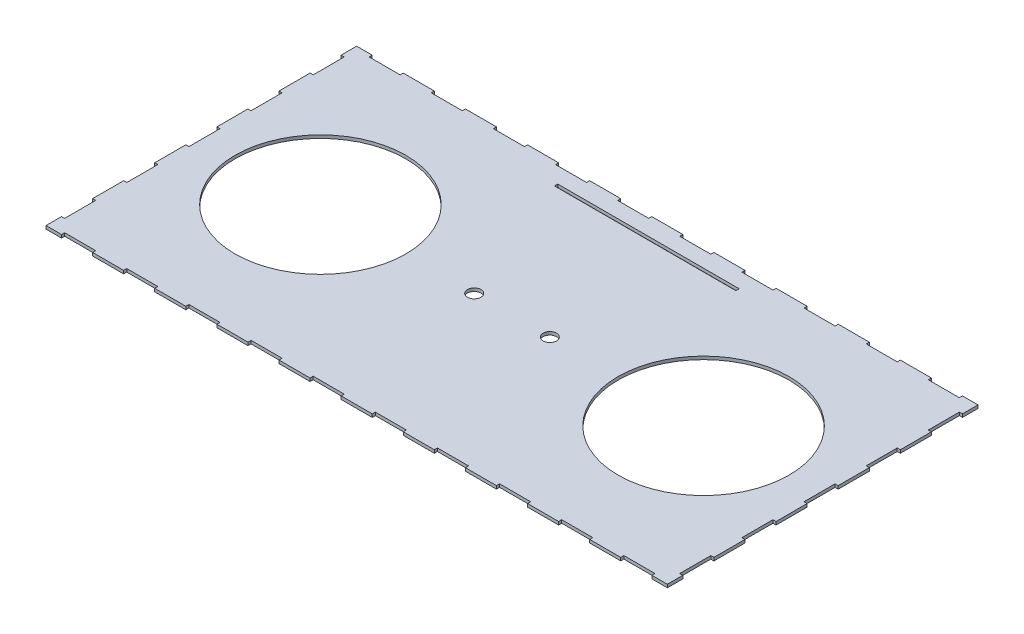
from build123d import *

# Parameters (mm, degrees)
SKETCH1_W           = 600
SKETCH1_H           = 300
BOSS_EXTRUDE1_DEPTH = 3
SKETCH2_R           = 82.5
SKETCH2_R_2         = 6.5
SKETCH2_W           = 30
SKETCH2_H           = 3
SKETCH2_W_2         = 3
SKETCH2_H_2         = 30
CUT_EXTRUDE2_DEPTH  = 5
SKETCH3_W           = 175.2
SKETCH3_H           = 3.2
CUT_EXTRUDE3_DEPTH  = 10


with BuildPart() as part:
    # Sketch1 → Boss-Extrude1 (new body)
    with BuildSketch(Plane(origin=(0, 0, 0), x_dir=(1, 0, 0), z_dir=(0, 1, 0))):
        with Locations((300, 150)):
            Rectangle(SKETCH1_W, SKETCH1_H)
    extrude(amount=BOSS_EXTRUDE1_DEPTH)

    # Sketch2 → Cut-Extrude2 (cut)
    with BuildSketch(Plane(origin=(0, 3, 0), x_dir=(1, 0, 0), z_dir=(0, 1, 0))):
        with Locations(Location((115, 150, 0), (0, 0, 270))):
            Circle(SKETCH2_R)
        with Locations(Location((263.5, 150, 0), (0, 0, 270))):
            Circle(SKETCH2_R_2)
        with Locations(Location((336.5, 150, 0), (0, 0, 90))):
            Circle(SKETCH2_R_2)
        with Locations(Location((485, 150, 0), (0, 0, 90))):
            Circle(SKETCH2_R)
        with Locations((90, 1.5)):
            Rectangle(SKETCH2_W, SKETCH2_H)
        with Locations((30, 1.5)):
            Rectangle(SKETCH2_W, SKETCH2_H)
        with Locations((150, 1.5)):
            Rectangle(SKETCH2_W, SKETCH2_H)
        with Locations((210, 1.5)):
            Rectangle(SKETCH2_W, SKETCH2_H)
        with Locations((270, 1.5)):
            Rectangle(SKETCH2_W, SKETCH2_H)
        with Locations((330, 1.5)):
            Rectangle(SKETCH2_W, SKETCH2_H)
        with Locations((390, 1.5)):
            Rectangle(SKETCH2_W, SKETCH2_H)
        with Locations((450, 1.5)):
            Rectangle(SKETCH2_W, SKETCH2_H)
        with Locations((510, 1.5)):
            Rectangle(SKETCH2_W, SKETCH2_H)
        with Locations((570, 1.5)):
            Rectangle(SKETCH2_W, SKETCH2_H)
        with Locations((570, 298.5)):
            Rectangle(SKETCH2_W, SKETCH2_H)
        with Locations((510, 298.5)):
            Rectangle(SKETCH2_W, SKETCH2_H)
        with Locations((450, 298.5)):
            Rectangle(SKETCH2_W, SKETCH2_H)
        with Locations((390, 298.5)):
            Rectangle(SKETCH2_W, SKETCH2_H)
        with Locations((330, 298.5)):
            Rectangle(SKETCH2_W, SKETCH2_H)
        with Locations((270, 298.5)):
            Rectangle(SKETCH2_W, SKETCH2_H)
        with Locations((210, 298.5)):
            Rectangle(SKETCH2_W, SKETCH2_H)
        with Locations((150, 298.5)):
            Rectangle(SKETCH2_W, SKETCH2_H)
        with Locations((90, 298.5)):
            Rectangle(SKETCH2_W, SKETCH2_H)
        with Locations((30, 298.5)):
            Rectangle(SKETCH2_W, SKETCH2_H)
        with Locations((1.5, 210)):
            Rectangle(SKETCH2_W_2, SKETCH2_H_2)
        with Locations((1.5, 270)):
            Rectangle(SKETCH2_W_2, SKETCH2_H_2)
        with Locations((1.5, 150)):
            Rectangle(SKETCH2_W_2, SKETCH2_H_2)
        with Locations((1.5, 90)):
            Rectangle(SKETCH2_W_2, SKETCH2_H_2)
        with Locations((1.5, 30)):
            Rectangle(SKETCH2_W_2, SKETCH2_H_2)
        with Locations((598.5, 30)):
            Rectangle(SKETCH2_W_2, SKETCH2_H_2)
        with Locations((598.5, 90)):
            Rectangle(SKETCH2_W_2, SKETCH2_H_2)
        with Locations((598.5, 150)):
            Rectangle(SKETCH2_W_2, SKETCH2_H_2)
        with Locations((598.5, 210)):
            Rectangle(SKETCH2_W_2, SKETCH2_H_2)
        with Locations((598.5, 270)):
            Rectangle(SKETCH2_W_2, SKETCH2_H_2)
    extrude(amount=-CUT_EXTRUDE2_DEPTH, mode=Mode.SUBTRACT)

    # Sketch3 → Cut-Extrude3 (cut)
    with BuildSketch(Plane(origin=(0, 3, 0), x_dir=(1, 0, 0), z_dir=(0, 1, 0))):
        with Locations((300, 280.2)):
            Rectangle(SKETCH3_W, SKETCH3_H)
    extrude(amount=-CUT_EXTRUDE3_DEPTH, mode=Mode.SUBTRACT)


solid = part.part
